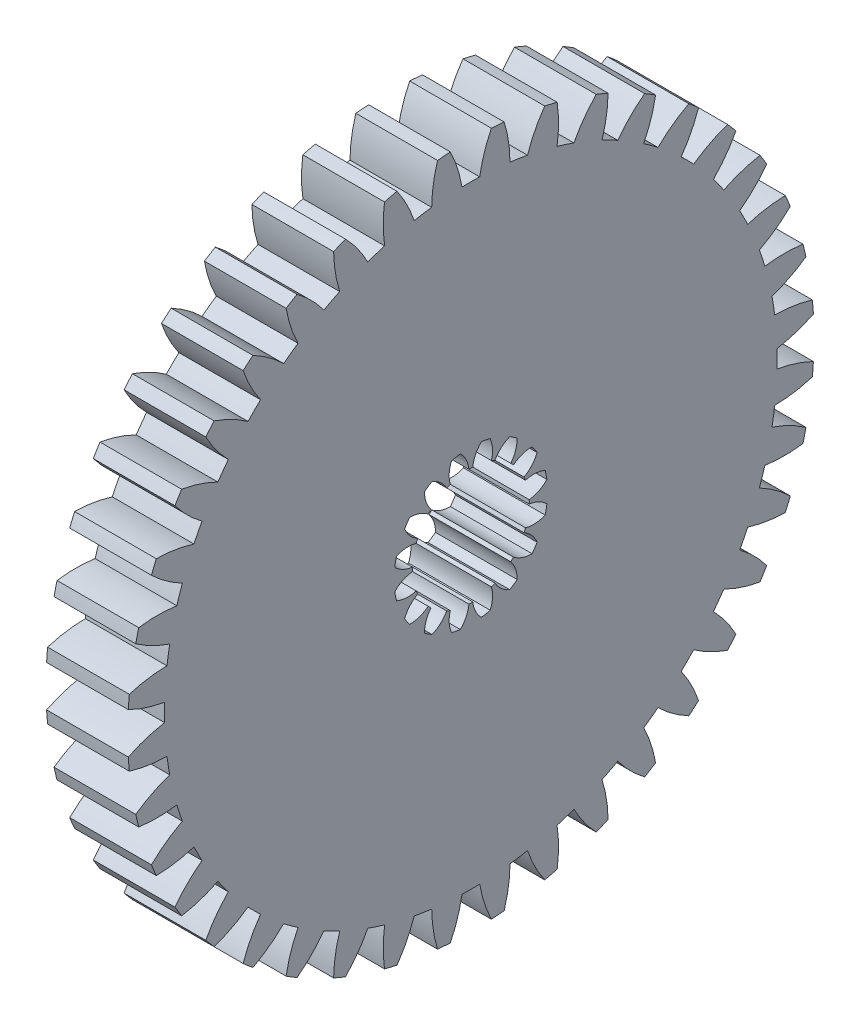
from build123d import *

# Parameters (mm, degrees)
BASPROSKE_W              = 5
BASPROSKE_H              = 21
TOOTHCUT_DEPTH           = 31.116440693
TEETHCUTS_COUNT          = 40
TEETHCUTS_ANGLE          = 351
BORSKE_R                 = 1
BORE_DEPTH               = 50.0000508
TAGLIO_ESTRUSIONE1_DEPTH = 10


with BuildPart() as part:
    # BasProSke → Base-Revolve (revolve)
    with BuildSketch(Plane(origin=(0, 0, 0), x_dir=(1, 0, 0), z_dir=(0, 1, 0)), mode=Mode.PRIVATE) as base_revolve_sk:
        with Locations((2.5, 10.5)):
            Rectangle(BASPROSKE_W, BASPROSKE_H)
    revolve(base_revolve_sk.sketch.rotate(Axis((-10, 0, 0), (1, 0, 0)), 180), axis=Axis((-10, 0, 0), (1, 0, 0)))

    # TooCutSke → ToothCut (cut, through all)
    with BuildSketch(Plane(origin=(0, 0, 0), x_dir=(0, 0, -1), z_dir=(1, 0, 0))):
        with BuildLine():
            ThreePointArc((0.541912224, 18.741166776), (0, 18.749), (-0.541912224, 18.741166776))
            ThreePointArc((-0.541912224, 18.741166776), (-0.82173342, 19.891076163), (-1.268136615, 20.987121639))
            ThreePointArc((-1.268136615, 20.987121639), (0, 21.0254), (1.268136615, 20.987121639))
            ThreePointArc((1.268136615, 20.987121639), (0.82173342, 19.891076163), (0.541912224, 18.741166776))
        make_face()
    toothcut = extrude(amount=TOOTHCUT_DEPTH, mode=Mode.SUBTRACT)

    # TeethCuts: ToothCut ×40 about axis
    teethcuts_axis = Axis((-10, 0, 0), (1, 0, 0))
    for i in range(1, TEETHCUTS_COUNT):
        add(toothcut.rotate(teethcuts_axis, i * TEETHCUTS_ANGLE / (TEETHCUTS_COUNT - 1)), mode=Mode.SUBTRACT)

    # BorSke → Bore (cut, symmetric)
    with BuildSketch(Plane(origin=(0, 0, 0), x_dir=(0, 0, -1), z_dir=(1, 0, 0))):
        with Locations(Location((0, 0, 0), (0, 0, 180))):
            Circle(BORSKE_R)
    extrude(amount=BORE_DEPTH, both=True, mode=Mode.SUBTRACT)

    # Schizzo2 → Taglio-Estrusione1 (cut)
    with BuildSketch(Plane(origin=(5, 0, 0), x_dir=(0, 0, -1), z_dir=(1, 0, 0))):
        with BuildLine():
            ThreePointArc((-0.117245432, 3.572076358), (-0.287738258, 4.159283684), (-0.644969227, 4.655535919))
            ThreePointArc((-0.644969227, 4.655535919), (-0.916924513, 4.609690818), (-1.185722597, 4.547973386))
            ThreePointArc((-1.185722597, 4.547973386), (-1.325853469, 3.952789729), (-1.258653786, 3.34503612))
            ThreePointArc((-1.258653786, 3.34503612), (-1.367710587, 3.301945449), (-1.475295097, 3.255300351))
            ThreePointArc((-1.475295097, 3.255300351), (-1.857524443, 3.732564401), (-2.377470333, 4.054335311))
            ThreePointArc((-2.377470333, 4.054335311), (-2.611180095, 3.907907178), (-2.835898905, 3.748023133))
            ThreePointArc((-2.835898905, 3.748023133), (-2.737596024, 3.144519371), (-2.442934375, 2.608744456))
            ThreePointArc((-2.442934375, 2.608744456), (-2.527199636, 2.527199636), (-2.608744456, 2.442934375))
            ThreePointArc((-2.608744456, 2.442934375), (-3.144519371, 2.737596024), (-3.748023133, 2.835898905))
            ThreePointArc((-3.748023133, 2.835898905), (-3.907907178, 2.611180095), (-4.054335311, 2.377470333))
            ThreePointArc((-4.054335311, 2.377470333), (-3.732564401, 1.857524443), (-3.255300351, 1.475295097))
            ThreePointArc((-3.255300351, 1.475295097), (-3.301945449, 1.367710587), (-3.34503612, 1.258653786))
            ThreePointArc((-3.34503612, 1.258653786), (-3.952789729, 1.325853469), (-4.547973386, 1.185722597))
            ThreePointArc((-4.547973386, 1.185722597), (-4.609690818, 0.916924513), (-4.655535919, 0.644969227))
            ThreePointArc((-4.655535919, 0.644969227), (-4.159283684, 0.287738258), (-3.572076358, 0.117245432))
            ThreePointArc((-3.572076358, 0.117245432), (-3.574, 0), (-3.572076358, -0.117245432))
            ThreePointArc((-3.572076358, -0.117245432), (-4.159283684, -0.287738258), (-4.655535919, -0.644969227))
            ThreePointArc((-4.655535919, -0.644969227), (-4.609690818, -0.916924513), (-4.547973386, -1.185722597))
            ThreePointArc((-4.547973386, -1.185722597), (-3.952789729, -1.325853469), (-3.34503612, -1.258653786))
            ThreePointArc((-3.34503612, -1.258653786), (-3.301945449, -1.367710587), (-3.255300351, -1.475295097))
            ThreePointArc((-3.255300351, -1.475295097), (-3.732564401, -1.857524443), (-4.054335311, -2.377470333))
            ThreePointArc((-4.054335311, -2.377470333), (-3.907907178, -2.611180095), (-3.748023133, -2.835898905))
            ThreePointArc((-3.748023133, -2.835898905), (-3.144519371, -2.737596024), (-2.608744456, -2.442934375))
            ThreePointArc((-2.608744456, -2.442934375), (-2.527199636, -2.527199636), (-2.442934375, -2.608744456))
            ThreePointArc((-2.442934375, -2.608744456), (-2.737596024, -3.144519371), (-2.835898905, -3.748023133))
            ThreePointArc((-2.835898905, -3.748023133), (-2.611180095, -3.907907178), (-2.377470333, -4.054335311))
            ThreePointArc((-2.377470333, -4.054335311), (-1.857524443, -3.732564401), (-1.475295097, -3.255300351))
            ThreePointArc((-1.475295097, -3.255300351), (-1.367710587, -3.301945449), (-1.258653786, -3.34503612))
            ThreePointArc((-1.258653786, -3.34503612), (-1.325853469, -3.952789729), (-1.185722597, -4.547973386))
            ThreePointArc((-1.185722597, -4.547973386), (-0.916924513, -4.609690818), (-0.644969227, -4.655535919))
            ThreePointArc((-0.644969227, -4.655535919), (-0.287738258, -4.159283684), (-0.117245432, -3.572076358))
            ThreePointArc((-0.117245432, -3.572076358), (0, -3.574), (0.117245432, -3.572076358))
            ThreePointArc((0.117245432, -3.572076358), (0.287738258, -4.159283684), (0.644969227, -4.655535919))
            ThreePointArc((0.644969227, -4.655535919), (0.916924513, -4.609690818), (1.185722597, -4.547973386))
            ThreePointArc((1.185722597, -4.547973386), (1.325853469, -3.952789729), (1.258653786, -3.34503612))
            ThreePointArc((1.258653786, -3.34503612), (1.367710587, -3.301945449), (1.475295097, -3.255300351))
            ThreePointArc((1.475295097, -3.255300351), (1.857524443, -3.732564401), (2.377470333, -4.054335311))
            ThreePointArc((2.377470333, -4.054335311), (2.611180095, -3.907907178), (2.835898905, -3.748023133))
            ThreePointArc((2.835898905, -3.748023133), (2.737596024, -3.144519371), (2.442934375, -2.608744456))
            ThreePointArc((2.442934375, -2.608744456), (2.527199636, -2.527199636), (2.608744456, -2.442934375))
            ThreePointArc((2.608744456, -2.442934375), (3.144519371, -2.737596024), (3.748023133, -2.835898905))
            ThreePointArc((3.748023133, -2.835898905), (3.907907178, -2.611180095), (4.054335311, -2.377470333))
            ThreePointArc((4.054335311, -2.377470333), (3.732564401, -1.857524443), (3.255300351, -1.475295097))
            ThreePointArc((3.255300351, -1.475295097), (3.301945449, -1.367710587), (3.34503612, -1.258653786))
            ThreePointArc((3.34503612, -1.258653786), (3.952789729, -1.325853469), (4.547973386, -1.185722597))
            ThreePointArc((4.547973386, -1.185722597), (4.609690818, -0.916924513), (4.655535919, -0.644969227))
            ThreePointArc((4.655535919, -0.644969227), (4.159283684, -0.287738258), (3.572076358, -0.117245432))
            ThreePointArc((3.572076358, -0.117245432), (3.574, 0), (3.572076358, 0.117245432))
            ThreePointArc((3.572076358, 0.117245432), (4.159283684, 0.287738258), (4.655535919, 0.644969227))
            ThreePointArc((4.655535919, 0.644969227), (4.609690818, 0.916924513), (4.547973386, 1.185722597))
            ThreePointArc((4.547973386, 1.185722597), (3.952789729, 1.325853469), (3.34503612, 1.258653786))
            ThreePointArc((3.34503612, 1.258653786), (3.301945449, 1.367710587), (3.255300351, 1.475295097))
            ThreePointArc((3.255300351, 1.475295097), (3.732564401, 1.857524443), (4.054335311, 2.377470333))
            ThreePointArc((4.054335311, 2.377470333), (3.907907178, 2.611180095), (3.748023133, 2.835898905))
            ThreePointArc((3.748023133, 2.835898905), (3.144519371, 2.737596024), (2.608744456, 2.442934375))
            ThreePointArc((2.608744456, 2.442934375), (2.527199636, 2.527199636), (2.442934375, 2.608744456))
            ThreePointArc((2.442934375, 2.608744456), (2.737596024, 3.144519371), (2.835898905, 3.748023133))
            ThreePointArc((2.835898905, 3.748023133), (2.611180095, 3.907907178), (2.377470333, 4.054335311))
            ThreePointArc((2.377470333, 4.054335311), (1.857524443, 3.732564401), (1.475295097, 3.255300351))
            ThreePointArc((1.475295097, 3.255300351), (1.367710587, 3.301945449), (1.258653786, 3.34503612))
            ThreePointArc((1.258653786, 3.34503612), (1.325853469, 3.952789729), (1.185722597, 4.547973386))
            ThreePointArc((1.185722597, 4.547973386), (0.916924513, 4.609690818), (0.644969227, 4.655535919))
            ThreePointArc((0.644969227, 4.655535919), (0.287738258, 4.159283684), (0.117245432, 3.572076358))
            ThreePointArc((0.117245432, 3.572076358), (0, 3.574), (-0.117245432, 3.572076358))
        make_face()
    extrude(amount=-TAGLIO_ESTRUSIONE1_DEPTH, mode=Mode.SUBTRACT)


solid = part.part
